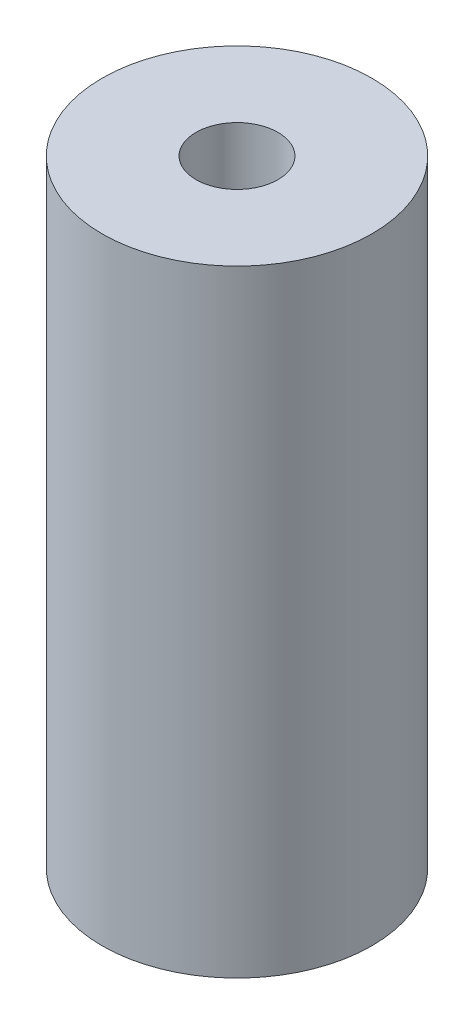
from build123d import *

# Parameters (mm, degrees)
SKETCH1_R           = 11.1125
SKETCH1_R_2         = 3.3782
BOSS_EXTRUDE1_DEPTH = 50.8


with BuildPart() as part:
    # Sketch1 → Boss-Extrude1 (new body)
    with BuildSketch(Plane(origin=(0, 0, 0), x_dir=(1, 0, 0), z_dir=(0, 1, 0))):
        with Locations(Location((0, 0, 0), (0, 0, 270))):
            Circle(SKETCH1_R)
        with Locations(Location((0, 0, 0), (0, 0, 270))):
            Circle(SKETCH1_R_2, mode=Mode.SUBTRACT)
    extrude(amount=BOSS_EXTRUDE1_DEPTH)


solid = part.part
